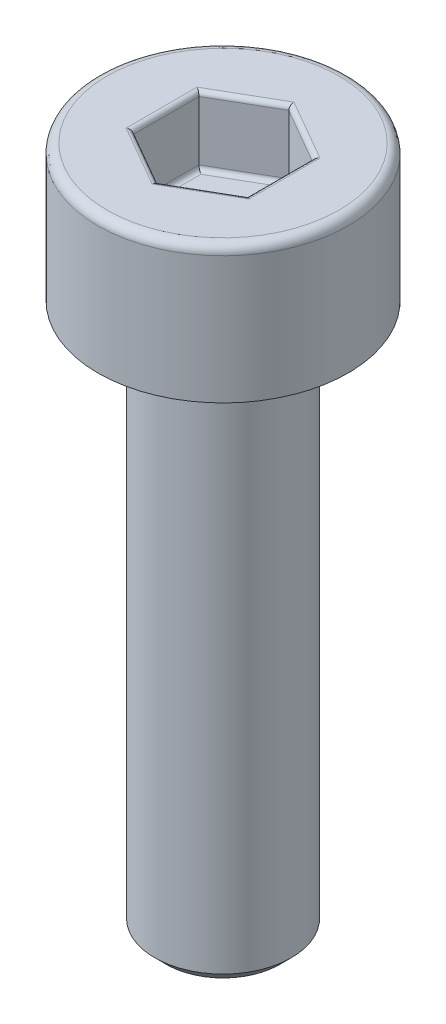
from build123d import *

# Parameters (mm, degrees)
CHAMFER1_SIZE      = 0.25
FILLET1_R          = 0.2
CUT_EXTRUDE1_DEPTH = 1.5
FILLET2_R          = 0.1


with BuildPart() as part:
    # Sketch1 → Revolve1 (revolve)
    with BuildSketch(Plane.XY, mode=Mode.PRIVATE) as revolve1_sk:
        Polygon((0, -15), (-1.5, -15), (-1.5, -3), (-2.75, -3), (-2.75, 0), (0, 0), align=None)
    revolve(revolve1_sk.sketch.rotate(Axis((0, 0, 0), (0, -1, 0)), 270), axis=Axis((0, 0, 0), (0, -1, 0)))

    # Chamfer1
    chamfer1_edges = [part.edges().sort_by_distance(p)[0] for p in [
        (0, -3, -1.5),
        (0, -15, -1.5),
    ]]
    chamfer(chamfer1_edges, length=CHAMFER1_SIZE)

    # Fillet1
    fillet1_edges = [part.edges().sort_by_distance(p)[0] for p in [
        (0, 0, -2.75),
    ]]
    fillet(fillet1_edges, radius=FILLET1_R)

    # Sketch2 → Cut-Extrude1 (cut)
    with BuildSketch(Plane(origin=(0, 0, 0), x_dir=(1, 0, 0), z_dir=(0, 1, 0))):
        Polygon((0, 1.443375673), (-1.25, 0.721687836), (-1.25, -0.721687836), (0, -1.443375673), (1.25, -0.721687836), (1.25, 0.721687836), align=None)
    extrude(amount=-CUT_EXTRUDE1_DEPTH, mode=Mode.SUBTRACT)

    # Fillet2
    fillet2_edges = [part.edges().sort_by_distance(p)[0] for p in [
        (0.625, -1.5, -1.082531755),
        (1.25, -1.5, 0),
        (0.625, -1.5, 1.082531755),
        (-0.625, -1.5, 1.082531755),
        (-1.25, -1.5, 0),
        (-0.625, -1.5, -1.082531755),
        (0.625, 0, -1.082531755),
        (-0.625, 0, -1.082531755),
        (-1.25, 0, 0),
        (-0.625, 0, 1.082531755),
        (0.625, 0, 1.082531755),
        (1.25, 0, 0),
    ]]
    fillet(fillet2_edges, radius=FILLET2_R)


solid = part.part
